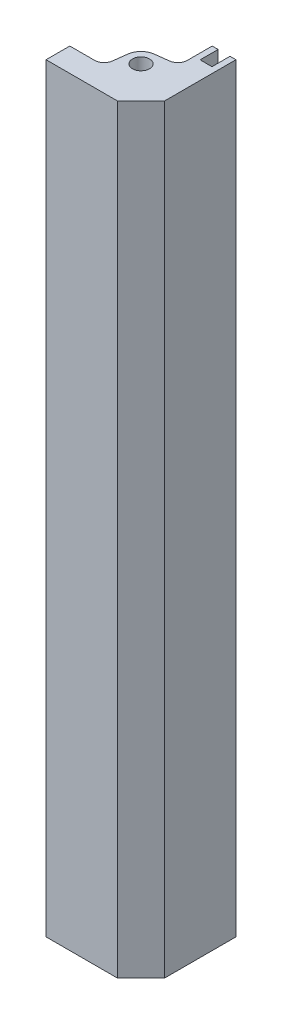
from build123d import *

# Parameters (mm, degrees)
BOSS_EXTRUDE1_DEPTH  = 203.2
SKETCH2_R            = 2.286
BOSS_EXTRUDE2_DEPTH  = 6.35
FILLET1_R            = 2.54
FILLET1_OF_MIRROR1_R = 2.54
SKETCH4_W            = 3.175
SKETCH4_H            = 4.826
CUT_EXTRUDE2_DEPTH   = 207.350575478
SKETCH5_W            = 19.05
SKETCH5_H            = 3.048
BOSS_EXTRUDE3_DEPTH  = 19.05
CHAMFER1_SIZE        = 6.35
CUT_EXTRUDE3_REACH   = 193.861
SKETCH6_W            = 14.2875
SKETCH6_H            = 14.2875


with BuildPart() as part:
    # Sketch1 → Boss-Extrude1 (new body)
    with BuildSketch(Plane(origin=(0, 0, 0), x_dir=(1, 0, 0), z_dir=(0, 1, 0))):
        Polygon((0, 0), (25.4, 0), (25.4, 25.4), (19.05, 25.4), (19.05, 6.35), (0, 6.35), align=None)
    extrude(amount=BOSS_EXTRUDE1_DEPTH)

    # Sketch2 → Boss-Extrude2 (add)
    with BuildSketch(Plane(origin=(0, 203.2, 0), x_dir=(1, 0, 0), z_dir=(0, 1, 0))):
        with BuildLine():
            Line((19.05, 16.51), (19.05, 6.35))
            Line((19.05, 6.35), (8.89, 6.35))
            Line((8.89, 6.35), (9.629456844, 12.244049961))
            ThreePointArc((9.629456844, 12.244049961), (10.788164369, 14.611835631), (13.155950039, 15.770543156))
            Line((13.155950039, 15.770543156), (19.05, 16.51))
        make_face()
        with Locations(Location((13.661846327, 11.738153673, 0), (0, 0, 270))):
            Circle(SKETCH2_R, mode=Mode.SUBTRACT)
    boss_extrude2 = extrude(amount=-BOSS_EXTRUDE2_DEPTH)

    # Fillet1
    fillet1_edges = [part.edges().sort_by_distance(p)[0] for p in [
        (8.89, 200.025, -6.35),
        (19.05, 200.025, -16.51),
    ]]
    fillet(fillet1_edges, radius=FILLET1_R)

    # Mirror1: Boss-Extrude2 across plane
    add(boss_extrude2.mirror(Plane.ZX.offset(101.6)))

    # Fillet1 of Mirror1
    fillet1_of_mirror1_edges = [part.edges().sort_by_distance(p)[0] for p in [
        (8.89, 3.175, -6.35),
        (19.05, 3.175, -16.51),
    ]]
    fillet(fillet1_of_mirror1_edges, radius=FILLET1_OF_MIRROR1_R)

    # Sketch4 → Cut-Extrude2 (cut, through all)
    with BuildSketch(Plane.XZ):
        with Locations((22.225, -22.987)):
            Rectangle(SKETCH4_W, SKETCH4_H)
    extrude(amount=-CUT_EXTRUDE2_DEPTH, mode=Mode.SUBTRACT)

    # Sketch5 → Boss-Extrude3 (add)
    with BuildSketch(Plane.ZY.offset(-19.05)):
        with Locations((-15.875, 180.848)):
            Rectangle(SKETCH5_W, SKETCH5_H)
        with Locations((-15.875, 186.944)):
            Rectangle(SKETCH5_W, SKETCH5_H)
        with Locations((-15.875, 174.752)):
            Rectangle(SKETCH5_W, SKETCH5_H)
        with Locations((-15.875, 168.656)):
            Rectangle(SKETCH5_W, SKETCH5_H)
        with Locations((-15.875, 162.56)):
            Rectangle(SKETCH5_W, SKETCH5_H)
        with Locations((-15.875, 156.464)):
            Rectangle(SKETCH5_W, SKETCH5_H)
        with Locations((-15.875, 150.368)):
            Rectangle(SKETCH5_W, SKETCH5_H)
        with Locations((-15.875, 144.272)):
            Rectangle(SKETCH5_W, SKETCH5_H)
        with Locations((-15.875, 138.176)):
            Rectangle(SKETCH5_W, SKETCH5_H)
        with Locations((-15.875, 132.08)):
            Rectangle(SKETCH5_W, SKETCH5_H)
        with Locations((-15.875, 125.984)):
            Rectangle(SKETCH5_W, SKETCH5_H)
        with Locations((-15.875, 119.888)):
            Rectangle(SKETCH5_W, SKETCH5_H)
        with Locations((-15.875, 113.792)):
            Rectangle(SKETCH5_W, SKETCH5_H)
        with Locations((-15.875, 107.696)):
            Rectangle(SKETCH5_W, SKETCH5_H)
        with Locations((-15.875, 101.6)):
            Rectangle(SKETCH5_W, SKETCH5_H)
        with Locations((-15.875, 95.504)):
            Rectangle(SKETCH5_W, SKETCH5_H)
        with Locations((-15.875, 89.408)):
            Rectangle(SKETCH5_W, SKETCH5_H)
        with Locations((-15.875, 83.312)):
            Rectangle(SKETCH5_W, SKETCH5_H)
        with Locations((-15.875, 77.216)):
            Rectangle(SKETCH5_W, SKETCH5_H)
        with Locations((-15.875, 71.12)):
            Rectangle(SKETCH5_W, SKETCH5_H)
        with Locations((-15.875, 65.024)):
            Rectangle(SKETCH5_W, SKETCH5_H)
        with Locations((-15.875, 58.928)):
            Rectangle(SKETCH5_W, SKETCH5_H)
        with Locations((-15.875, 52.832)):
            Rectangle(SKETCH5_W, SKETCH5_H)
        with Locations((-15.875, 46.736)):
            Rectangle(SKETCH5_W, SKETCH5_H)
        with Locations((-15.875, 40.64)):
            Rectangle(SKETCH5_W, SKETCH5_H)
        with Locations((-15.875, 34.544)):
            Rectangle(SKETCH5_W, SKETCH5_H)
        with Locations((-15.875, 28.448)):
            Rectangle(SKETCH5_W, SKETCH5_H)
        with Locations((-15.875, 22.352)):
            Rectangle(SKETCH5_W, SKETCH5_H)
        with Locations((-15.875, 16.256)):
            Rectangle(SKETCH5_W, SKETCH5_H)
    extrude(amount=BOSS_EXTRUDE3_DEPTH)

    # Chamfer1
    chamfer1_edges = [part.edges().sort_by_distance(p)[0] for p in [
        (25.4, 101.6, 0),
    ]]
    chamfer(chamfer1_edges, length=CHAMFER1_SIZE)

    # Cut-Extrude3: up to this face of the body (flat: up to its plane)
    cut_extrude3_end = Plane(part.part.faces().sort_by_distance((9.525, 14.732, -15.875))[0])
    # Sketch6 → Cut-Extrude3 (cut, up to the picked face)
    with BuildSketch(Plane(origin=(0, 188.468, 0), x_dir=(1, 0, 0), z_dir=(0, 1, 0)), mode=Mode.PRIVATE) as cut_extrude3_sk1:
        with Locations((7.14375, 18.25625)):
            Rectangle(SKETCH6_W, SKETCH6_H)
    cut_extrude3_tool1 = split(extrude(cut_extrude3_sk1.sketch, amount=-CUT_EXTRUDE3_REACH, mode=Mode.PRIVATE), bisect_by=cut_extrude3_end, keep=Keep.BOTH, mode=Mode.PRIVATE)
    add(cut_extrude3_tool1.solids().sort_by(Axis((7.14375, 188.468, -18.25625), (0, -1, 0)))[0], mode=Mode.SUBTRACT)


solid = part.part
